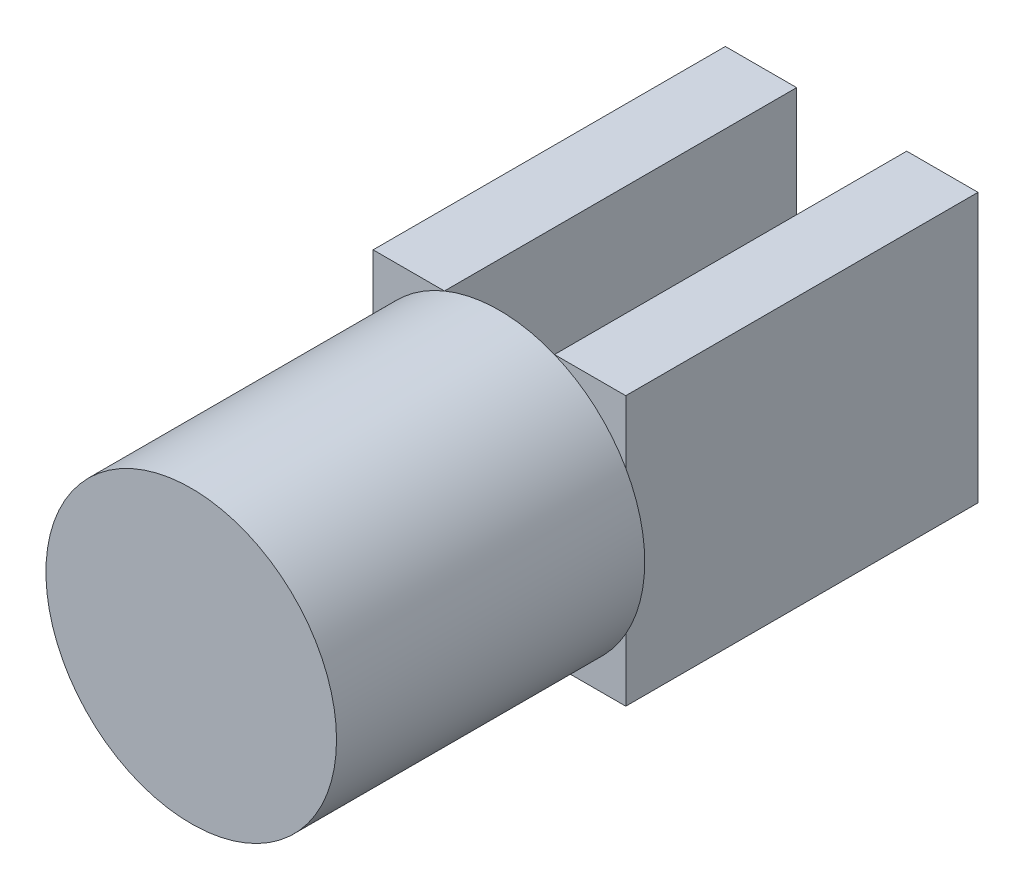
from build123d import *

# Parameters (mm, degrees)
SKETCH_1_R      = 33
EXTRUDE_1_DEPTH = 70
SKETCH_2_W      = 16.190565304
SKETCH_2_H      = 61.081912216
EXTRUDE_3_DEPTH = 80


with BuildPart() as part:
    # 草图1 → 凸台-拉伸1 (new body)
    with BuildSketch(Plane.XY):
        Circle(SKETCH_1_R)
    extrude(amount=EXTRUDE_1_DEPTH)

    # 草图2 → 凸台-拉伸3 (add)
    with BuildSketch(Plane(origin=(0, 0, 0), x_dir=(-1, 0, 0), z_dir=(0, 0, -1))):
        with Locations((-20.595282652, 0)):
            Rectangle(SKETCH_2_W, SKETCH_2_H)
        with Locations((20.595282652, 0)):
            Rectangle(SKETCH_2_W, SKETCH_2_H)
    extrude(amount=EXTRUDE_3_DEPTH)


solid = part.part
